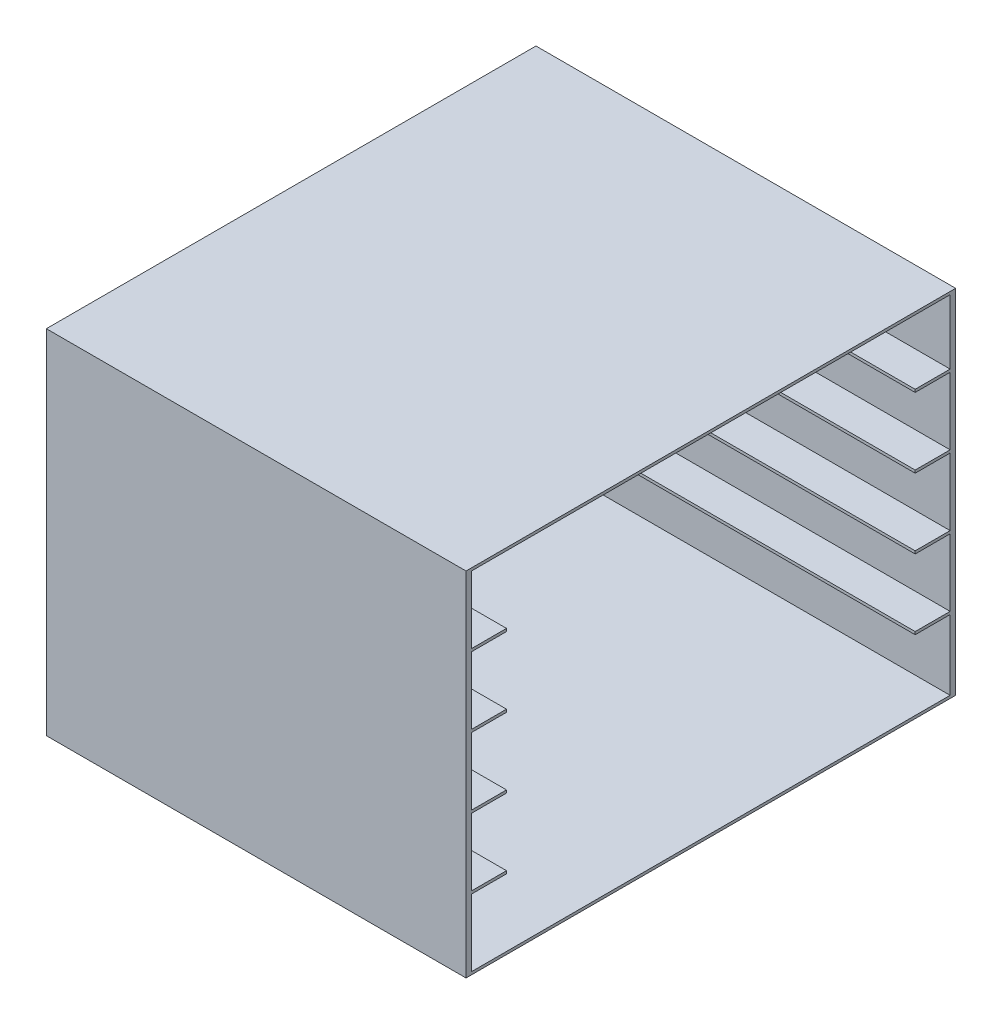
from build123d import *

# Parameters (mm, degrees)
SKETCH1_W           = 152.4
SKETCH1_H           = 177.8
BOSS_EXTRUDE1_DEPTH = 1
SKETCH15_W          = 152.4
SKETCH15_H          = 2
EXTRUDE_THIN1_DEPTH = 127
SKETCH16_W          = 152.4
SKETCH16_H          = 1
EXTRUDE_THIN2_DEPTH = 12.7
SKETCH17_W          = 152.4
SKETCH17_H          = 1
EXTRUDE_THIN3_DEPTH = 12.7
SKETCH18_W          = 152.4
SKETCH18_H          = 1
EXTRUDE_THIN4_DEPTH = 173.8


with BuildPart() as part:
    # Sketch1 → Boss-Extrude1 (new body)
    with BuildSketch(Plane(origin=(0, 0, 0), x_dir=(1, 0, 0), z_dir=(0, 1, 0))):
        Rectangle(SKETCH1_W, SKETCH1_H)
    extrude(amount=BOSS_EXTRUDE1_DEPTH)

    # Sketch15 → Extrude-Thin1 (add)
    with BuildSketch(Plane(origin=(0, 1, 0), x_dir=(1, 0, 0), z_dir=(0, 1, 0))):
        with Locations((0, -87.9)):
            Rectangle(SKETCH15_W, SKETCH15_H)
        with Locations((0, 87.9)):
            Rectangle(SKETCH15_W, SKETCH15_H)
    extrude(amount=EXTRUDE_THIN1_DEPTH)

    # Sketch16 → Extrude-Thin2 (add)
    with BuildSketch(Plane(origin=(0, 0, 86.9), x_dir=(-1, 0, 0), z_dir=(0, 0, -1))):
        with Locations((0, 25.9)):
            Rectangle(SKETCH16_W, SKETCH16_H)
        with Locations((0, 51.3)):
            Rectangle(SKETCH16_W, SKETCH16_H)
        with Locations((0, 76.7)):
            Rectangle(SKETCH16_W, SKETCH16_H)
        with Locations((0, 102.1)):
            Rectangle(SKETCH16_W, SKETCH16_H)
    extrude(amount=EXTRUDE_THIN2_DEPTH)

    # Sketch17 → Extrude-Thin3 (add)
    with BuildSketch(Plane.XY.offset(-86.9)):
        with Locations((0, 26.9)):
            Rectangle(SKETCH17_W, SKETCH17_H)
        with Locations((0, 52.3)):
            Rectangle(SKETCH17_W, SKETCH17_H)
        with Locations((0, 77.7)):
            Rectangle(SKETCH17_W, SKETCH17_H)
        with Locations((0, 103.1)):
            Rectangle(SKETCH17_W, SKETCH17_H)
    extrude(amount=EXTRUDE_THIN3_DEPTH)

    # Sketch18 → Extrude-Thin4 (add)
    with BuildSketch(Plane(origin=(0, 0, 86.9), x_dir=(-1, 0, 0), z_dir=(0, 0, -1))):
        with Locations((0, 127.5)):
            Rectangle(SKETCH18_W, SKETCH18_H)
    extrude(amount=EXTRUDE_THIN4_DEPTH)


solid = part.part
